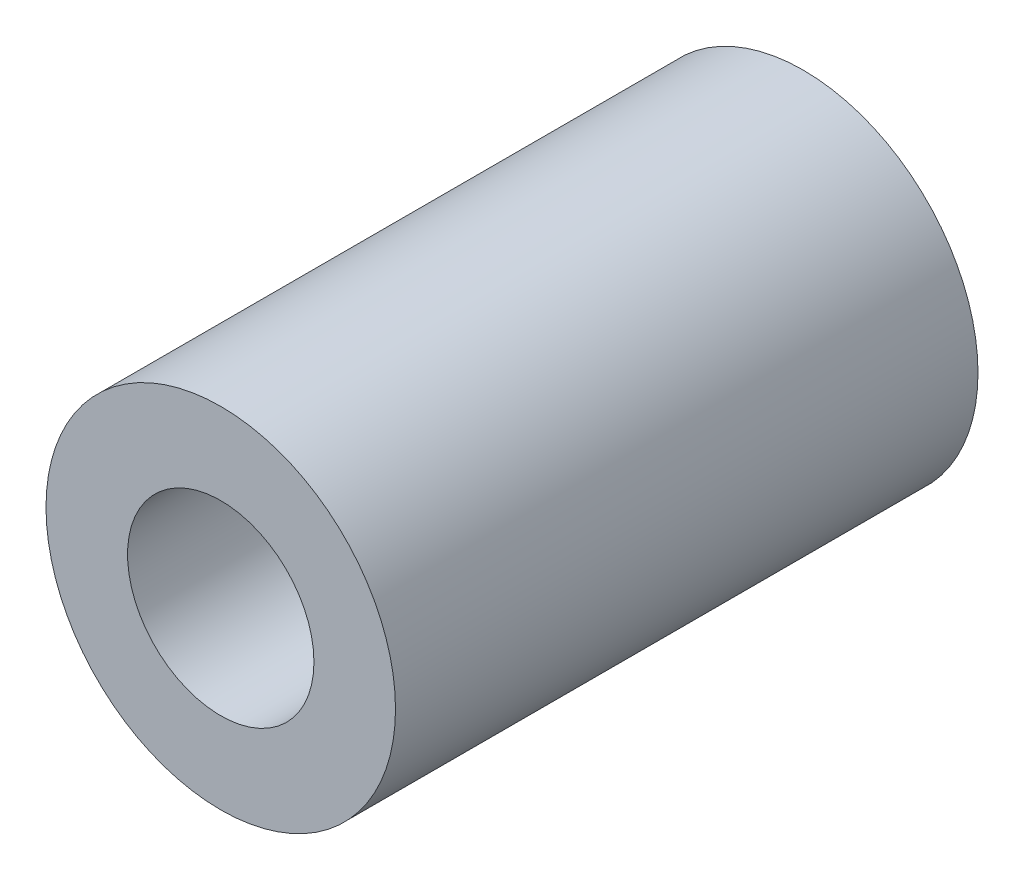
from build123d import *

# Parameters (mm, degrees)
SKETCH1_R           = 4.7625
SKETCH1_R_2         = 2.54
BOSS_EXTRUDE1_DEPTH = 15.875


with BuildPart() as part:
    # Sketch1 → Boss-Extrude1 (new body)
    with BuildSketch(Plane.XY):
        Circle(SKETCH1_R)
        Circle(SKETCH1_R_2, mode=Mode.SUBTRACT)
    extrude(amount=BOSS_EXTRUDE1_DEPTH)


solid = part.part
